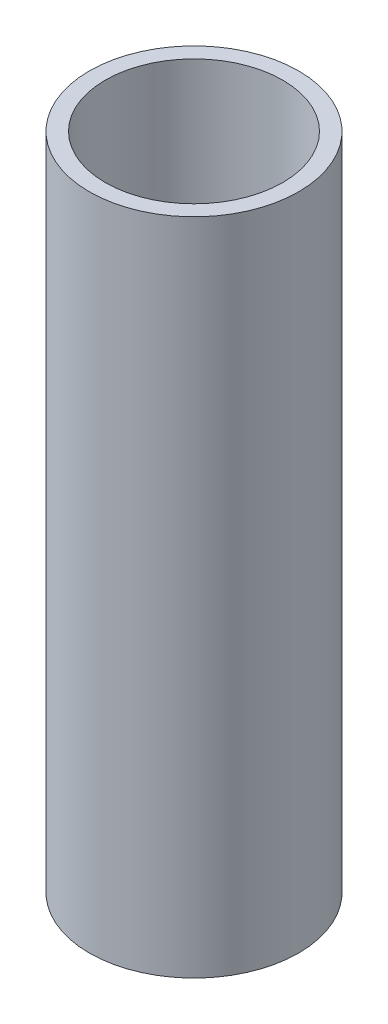
from build123d import *

# Parameters (mm, degrees)
SKETCH1_R           = 15.875
SKETCH1_R_2         = 13.462
BOSS_EXTRUDE1_DEPTH = 100


with BuildPart() as part:
    # Sketch1 → Boss-Extrude1 (new body)
    with BuildSketch(Plane(origin=(0, 0, 0), x_dir=(1, 0, 0), z_dir=(0, 1, 0))):
        with Locations(Location((0, 0, 0), (0, 0, 270))):
            Circle(SKETCH1_R)
        with Locations(Location((0, 0, 0), (0, 0, 270))):
            Circle(SKETCH1_R_2, mode=Mode.SUBTRACT)
    extrude(amount=BOSS_EXTRUDE1_DEPTH)


solid = part.part
